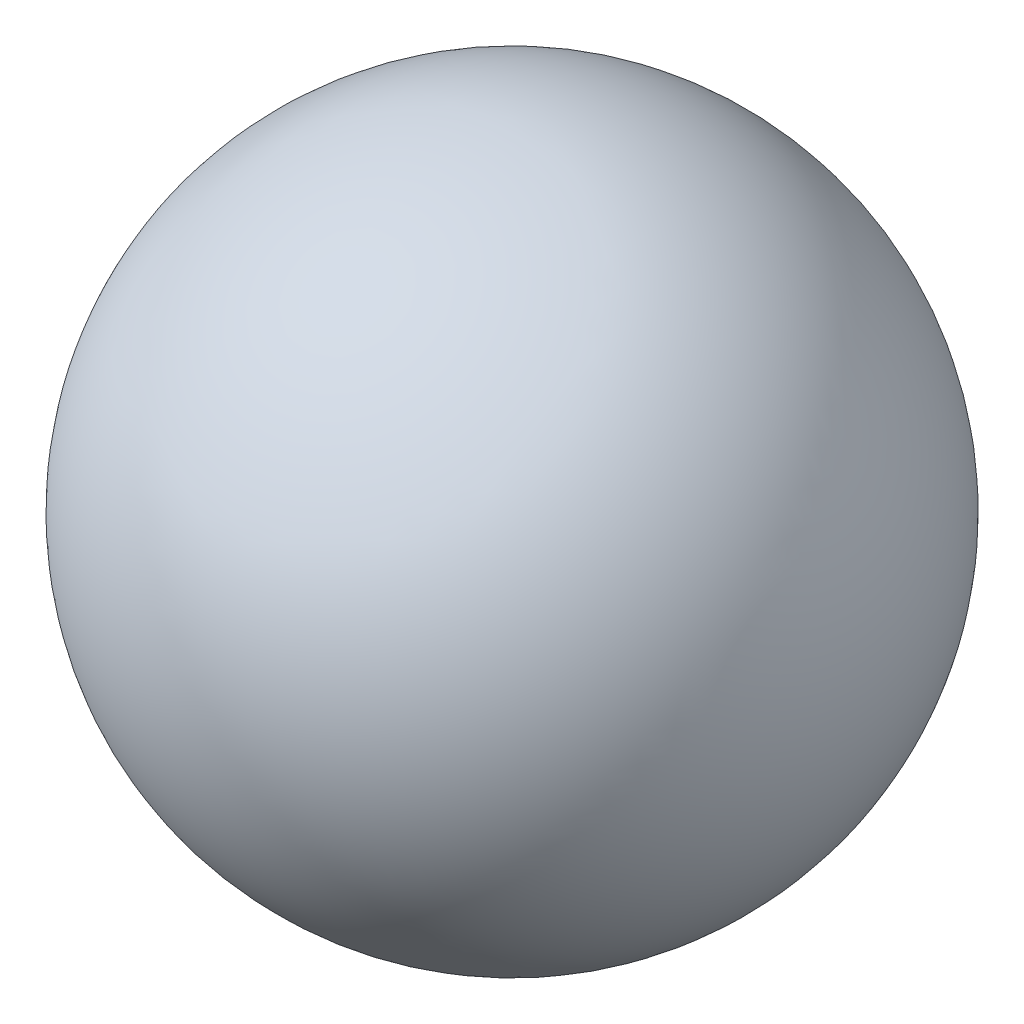
from build123d import *


with BuildPart() as part:
    # Esquisse1 → Base-Révolution (revolve)
    with BuildSketch(Plane.XY):
        with BuildLine():
            Line((-2.857142857, 22.5), (2.857142857, 22.5))
            ThreePointArc((2.857142857, 22.5), (0, 25.357142857), (-2.857142857, 22.5))
        make_face()
    revolve(axis=Axis((4.887863217, 22.5, 0), (-1, 0, 0)))


solid = part.part
